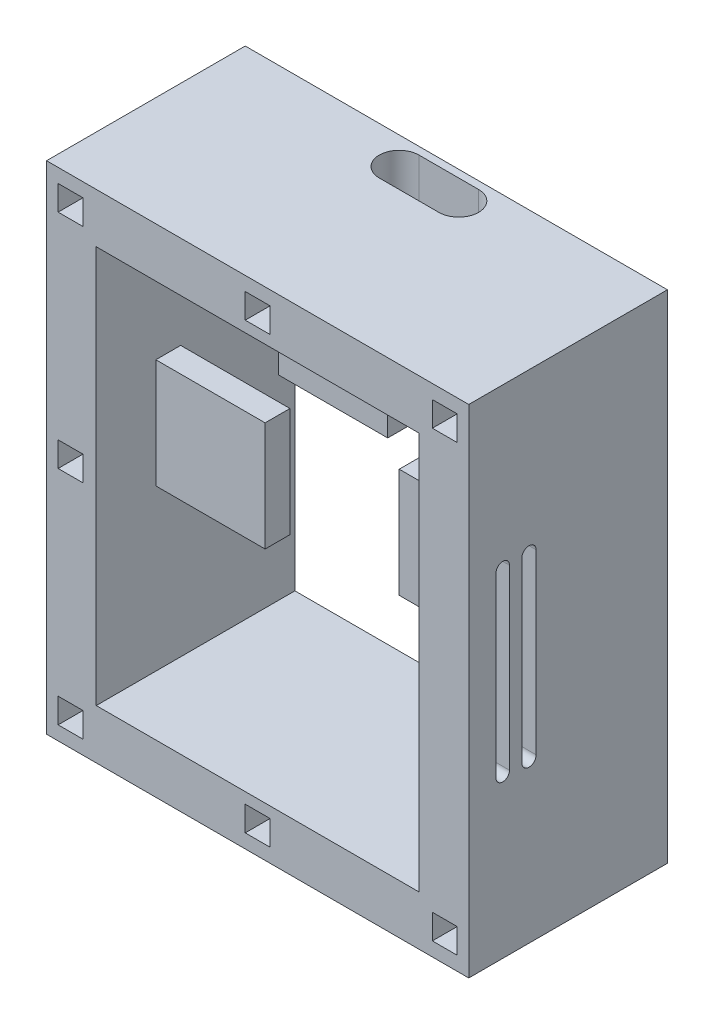
from build123d import *

# Parameters (mm, degrees)
SKETCH1_W            = 100
SKETCH1_H            = 85
SKETCH1_W_2          = 80
SKETCH1_H_2          = 65
BOSS_EXTRUDE1_DEPTH  = 40
SKETCH14_W           = 5
SKETCH14_H           = 5
CUT_EXTRUDE11_DEPTH  = 10
CUT_EXTRUDE16_REACH  = 117.785
SKETCH24_W           = 22
SKETCH24_H           = 22
BOSS_EXTRUDE13_DEPTH = 6
CUT_EXTRUDE17_REACH  = 108.419
SKETCH32_W           = 22
SKETCH32_H           = 22
BOSS_EXTRUDE17_DEPTH = 6
SKETCH33_W           = 5
SKETCH33_H           = 5
CUT_EXTRUDE18_DEPTH  = 10
SKETCH36_W           = 22
SKETCH36_H           = 22
BOSS_EXTRUDE19_DEPTH = 5


with BuildPart() as part:
    # Sketch1 → Boss-Extrude1 (new body)
    with BuildSketch(Plane(origin=(0, 0, 0), x_dir=(0, 1, 0), z_dir=(0, 0, 1))):
        Rectangle(SKETCH1_W, SKETCH1_H)
        Rectangle(SKETCH1_W_2, SKETCH1_H_2, mode=Mode.SUBTRACT)
    extrude(amount=BOSS_EXTRUDE1_DEPTH)

    # Sketch14 → Cut-Extrude11 (cut)
    with BuildSketch(Plane.XY.offset(40)):
        with Locations((-37.671132401, 44.6965107)):
            Rectangle(SKETCH14_W, SKETCH14_H)
        with Locations((-37.671132401, -44.6965107)):
            Rectangle(SKETCH14_W, SKETCH14_H)
        with Locations((37.671132401, 44.6965107)):
            Rectangle(SKETCH14_W, SKETCH14_H)
        with Locations((37.671132401, -44.6965107)):
            Rectangle(SKETCH14_W, SKETCH14_H)
        with Locations((0, 44.6965107)):
            Rectangle(SKETCH14_W, SKETCH14_H)
        with Locations((0, -44.6965107)):
            Rectangle(SKETCH14_W, SKETCH14_H)
        with Locations((-37.671132401, 0)):
            Rectangle(SKETCH14_W, SKETCH14_H)
    extrude(amount=-CUT_EXTRUDE11_DEPTH, mode=Mode.SUBTRACT)

    # Sketch22 → Cut-Extrude16 (cut, up to next)
    with BuildSketch(Plane(origin=(0, 50, 0), x_dir=(-1, 0, 0), z_dir=(0, 1, 0)), mode=Mode.PRIVATE) as cut_extrude16_sk1:
        with BuildLine():
            Line((-6, 9.521249719), (6, 9.521249719))
            ThreePointArc((6, 9.521249719), (10, 5.521249719), (6, 1.521249719))
            Line((6, 1.521249719), (-6, 1.521249719))
            ThreePointArc((-6, 1.521249719), (-10, 5.521249719), (-6, 9.521249719))
        make_face()
    cut_extrude16_tool1 = extrude(cut_extrude16_sk1.sketch, amount=-CUT_EXTRUDE16_REACH, mode=Mode.PRIVATE) & part.part
    add(cut_extrude16_tool1.solids().sort_by_distance((0, 50, 5.52125))[0], mode=Mode.SUBTRACT)

    # Sketch24 → Boss-Extrude13 (add)
    with BuildSketch(Plane.XY.offset(16)):
        with Locations((21.5, 2.716540801)):
            Rectangle(SKETCH24_W, SKETCH24_H)
    extrude(amount=BOSS_EXTRUDE13_DEPTH)

    # Sketch12 → Cut-Extrude17 (cut, up to next)
    with BuildSketch(Plane.YZ.offset(42.5), mode=Mode.PRIVATE) as cut_extrude17_sk1:
        with BuildLine():
            Line((-17.870386686, 34.517617013), (17.870386686, 34.517617013))
            ThreePointArc((17.870386686, 34.517617013), (19.229729644, 33.158274056), (17.870386686, 31.798931098))
            Line((17.870386686, 31.798931098), (-17.870386686, 31.798931098))
            ThreePointArc((-17.870386686, 31.798931098), (-19.229729644, 33.158274056), (-17.870386686, 34.517617013))
        make_face()
    cut_extrude17_tool1 = extrude(cut_extrude17_sk1.sketch, amount=-CUT_EXTRUDE17_REACH, mode=Mode.PRIVATE) & part.part
    # Sketch12 → Cut-Extrude17 (cut, up to next)
    with BuildSketch(Plane.YZ.offset(42.5), mode=Mode.PRIVATE) as cut_extrude17_sk2:
        with BuildLine():
            Line((-17.870386686, 29.316472465), (17.870386686, 29.316472465))
            ThreePointArc((17.870386686, 29.316472465), (19.31261641, 27.874242742), (17.870386686, 26.432013019))
            Line((17.870386686, 26.432013019), (-17.870386686, 26.432013019))
            ThreePointArc((-17.870386686, 26.432013019), (-19.31261641, 27.874242742), (-17.870386686, 29.316472465))
        make_face()
    cut_extrude17_tool2 = extrude(cut_extrude17_sk2.sketch, amount=-CUT_EXTRUDE17_REACH, mode=Mode.PRIVATE) & part.part
    add(cut_extrude17_tool1.solids().sort_by_distance((42.5, 0, 33.158274))[0], mode=Mode.SUBTRACT)
    add(cut_extrude17_tool2.solids().sort_by_distance((42.5, 0, 27.874243))[0], mode=Mode.SUBTRACT)

    # Sketch32 → Boss-Extrude17 (add)
    with BuildSketch(Plane.XY.offset(16)):
        with Locations((-2.810397874, 29)):
            Rectangle(SKETCH32_W, SKETCH32_H)
    extrude(amount=BOSS_EXTRUDE17_DEPTH)

    # Sketch33 → Cut-Extrude18 (cut)
    with BuildSketch(Plane(origin=(0, 0, 0), x_dir=(1, 0, 0), z_dir=(0, 0, -1))):
        with Locations((-37.671132401, 44.6965107)):
            Rectangle(SKETCH33_W, SKETCH33_H)
        with Locations((0, 44.6965107)):
            Rectangle(SKETCH33_W, SKETCH33_H)
        with Locations((37.671132401, 44.6965107)):
            Rectangle(SKETCH33_W, SKETCH33_H)
        with Locations((-37.671132401, 0)):
            Rectangle(SKETCH33_W, SKETCH33_H)
        with Locations((-37.671132401, -44.6965107)):
            Rectangle(SKETCH33_W, SKETCH33_H)
        with Locations((37.671132401, -44.6965107)):
            Rectangle(SKETCH33_W, SKETCH33_H)
    extrude(amount=-CUT_EXTRUDE18_DEPTH, mode=Mode.SUBTRACT)

    # Sketch36 → Boss-Extrude19 (add)
    with BuildSketch(Plane.XY.offset(23)):
        with Locations((-21.5, 3.296429393)):
            Rectangle(SKETCH36_W, SKETCH36_H)
    extrude(amount=BOSS_EXTRUDE19_DEPTH)


solid = part.part
